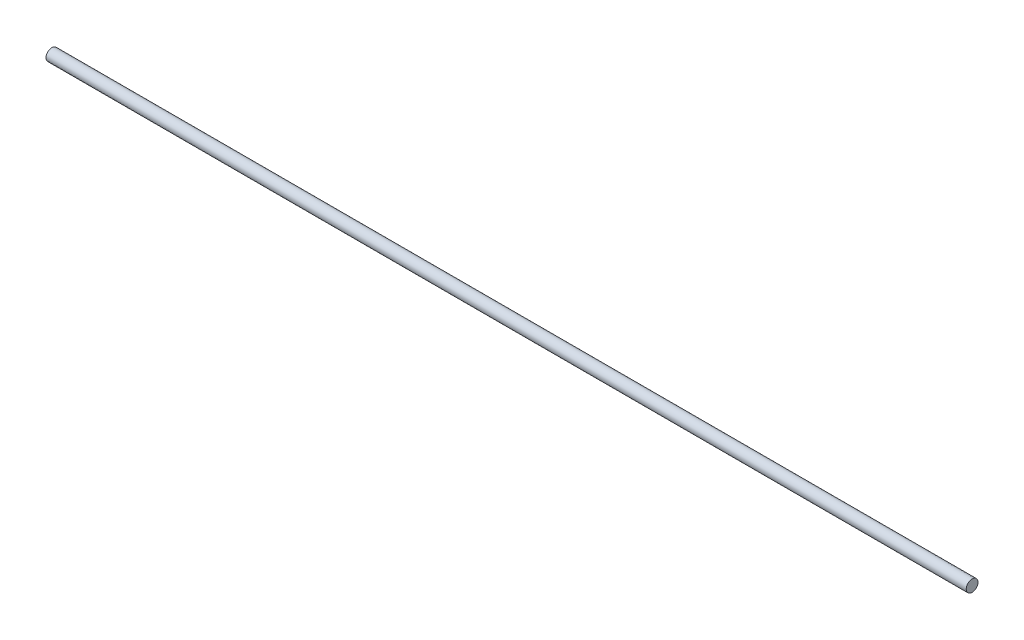
from build123d import *

# Parameters (mm, degrees)
BOSS_EXTRUDE1_DEPTH      = 185
BOSS_EXTRUDE1_DEPTH_BACK = 34
SKETCH1_R                = 1.4


with BuildPart() as part:
    # Sketch1 → Boss-Extrude1 (new, two sides: drawn at the far end of the back side and taken through both)
    with BuildSketch(Plane(origin=(0, 0, 0), x_dir=(0, 0, -1), z_dir=(1, 0, 0)).offset(-BOSS_EXTRUDE1_DEPTH_BACK)):
        Circle(SKETCH1_R)
    extrude(amount=BOSS_EXTRUDE1_DEPTH + BOSS_EXTRUDE1_DEPTH_BACK)


solid = part.part
